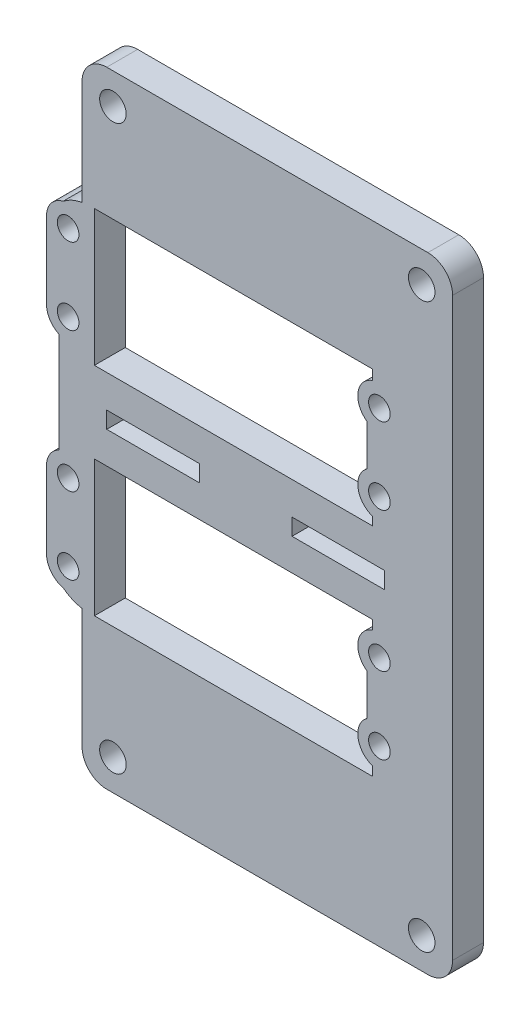
from build123d import *

# Parameters (mm, degrees)
SKETCH1_R           = 1.75
SKETCH1_R_2         = 2.15
SKETCH1_W           = 15
SKETCH1_H           = 2.7
BOSS_EXTRUDE1_DEPTH = 5


with BuildPart() as part:
    # Sketch1 → Boss-Extrude1 (new body)
    with BuildSketch(Plane.XY):
        with BuildLine():
            Line((33.050798555, 66.930419372), (-18.949201445, 66.930419372))
            ThreePointArc((-18.949201445, 66.930419372), (-21.77762857, 65.758846497), (-22.949201445, 62.930419372))
            Line((-22.949201445, 62.930419372), (-22.949201445, 45.959184597))
            add(Edge.make_bspline(
                [(-26.015204316, 44.603739403), (-25.073035607, 45.327145808), (-24.05103465, 45.778960873), (-22.949201445, 45.959184597)],
                knots=[0, 0, 0, 0, 0.632660701, 0.632660701, 0.632660701, 0.632660701], degree=3))
            ThreePointArc((-26.015204316, 44.603739403), (-27.948018841, 43.367577553), (-28.7, 41.2))
            Line((-28.7, 41.2), (-28.7, 28.8))
            ThreePointArc((-28.7, 28.8), (-28.151687317, 26.919164552), (-26.678547439, 25.62763535))
            Line((-26.678547439, 25.62763535), (-26.678547439, 9.37236465))
            ThreePointArc((-26.678547439, 9.37236465), (-28.151687317, 8.080835448), (-28.7, 6.2))
            Line((-28.7, 6.2), (-28.7, -6.2))
            ThreePointArc((-28.7, -6.2), (-27.948018841, -8.367577553), (-26.015204316, -9.603739403))
            add(Edge.make_bspline(
                [(-26.015204316, -9.603739403), (-25.073035607, -10.327145808), (-24.05103465, -10.778960873), (-22.949201445, -10.959184597)],
                knots=[0, 0, 0, 0, 0.632660701, 0.632660701, 0.632660701, 0.632660701], degree=3))
            Line((-22.949201445, -10.959184597), (-22.949201445, -30.315366628))
            ThreePointArc((-22.949201445, -30.315366628), (-21.77762857, -33.143793753), (-18.949201445, -34.315366628))
            Line((-18.949201445, -34.315366628), (33.050798555, -34.315366628))
            ThreePointArc((33.050798555, -34.315366628), (35.879225679, -33.143793753), (37.050798555, -30.315366628))
            Line((37.050798555, -30.315366628), (37.050798555, 62.930419372))
            ThreePointArc((37.050798555, 62.930419372), (35.879225679, 65.758846497), (33.050798555, 66.930419372))
        make_face()
        with Locations((-25.2, -6.2)):
            Circle(SKETCH1_R, mode=Mode.SUBTRACT)
        with Locations((-25.2, 6.2)):
            Circle(SKETCH1_R, mode=Mode.SUBTRACT)
        with Locations((-17.949201445, 61.930418903)):
            Circle(SKETCH1_R_2, mode=Mode.SUBTRACT)
        with Locations((32.050798555, 61.930418903)):
            Circle(SKETCH1_R_2, mode=Mode.SUBTRACT)
        with Locations((32.050798555, -29.315366628)):
            Circle(SKETCH1_R_2, mode=Mode.SUBTRACT)
        with Locations((-17.949201445, -29.315366628)):
            Circle(SKETCH1_R_2, mode=Mode.SUBTRACT)
        with Locations((25.2, 28.8)):
            Circle(SKETCH1_R, mode=Mode.SUBTRACT)
        with Locations((25.2, 41.2)):
            Circle(SKETCH1_R, mode=Mode.SUBTRACT)
        with Locations((-25.2, 28.8)):
            Circle(SKETCH1_R, mode=Mode.SUBTRACT)
        with Locations((-25.2, 41.2)):
            Circle(SKETCH1_R, mode=Mode.SUBTRACT)
        with Locations((25.2, 6.2)):
            Circle(SKETCH1_R, mode=Mode.SUBTRACT)
        with Locations((25.2, -6.2)):
            Circle(SKETCH1_R, mode=Mode.SUBTRACT)
        with BuildLine():
            Line((-20.949201445, 46.122161619), (24.050798555, 46.122161619))
            Line((24.050798555, 46.122161619), (24.050798555, 44.505954633))
            ThreePointArc((24.050798555, 44.505954633), (21.732055874, 41.672613518), (23.208062077, 38.322121735))
            Line((23.208062077, 38.322121735), (23.208062077, 31.677878265))
            ThreePointArc((23.208062077, 31.677878265), (21.732055874, 28.327386482), (24.050798555, 25.494045367))
            Line((24.050798555, 25.494045367), (24.050798555, 24.122161619))
            Line((24.050798555, 24.122161619), (-20.949201445, 24.122161619))
            Line((-20.949201445, 24.122161619), (-20.949201445, 46.122161619))
        make_face(mode=Mode.SUBTRACT)
        with BuildLine():
            Line((-20.949201445, 11.001569649), (24.050798555, 11.001569649))
            Line((24.050798555, 11.001569649), (24.050798555, 9.505954633))
            ThreePointArc((24.050798555, 9.505954633), (21.732055874, 6.672613518), (23.208062077, 3.322121735))
            Line((23.208062077, 3.322121735), (23.208062077, -3.322121735))
            ThreePointArc((23.208062077, -3.322121735), (21.732055874, -6.672613518), (24.050798555, -9.505954633))
            Line((24.050798555, -9.505954633), (24.050798555, -10.998430351))
            Line((24.050798555, -10.998430351), (-20.949201445, -10.998430351))
            Line((-20.949201445, -10.998430351), (-20.949201445, 11.001569649))
        make_face(mode=Mode.SUBTRACT)
        with Locations((-11.449201445, 17.5)):
            Rectangle(SKETCH1_W, SKETCH1_H, mode=Mode.SUBTRACT)
        with Locations((18.550798555, 17.5)):
            Rectangle(SKETCH1_W, SKETCH1_H, mode=Mode.SUBTRACT)
    extrude(amount=BOSS_EXTRUDE1_DEPTH)


solid = part.part
